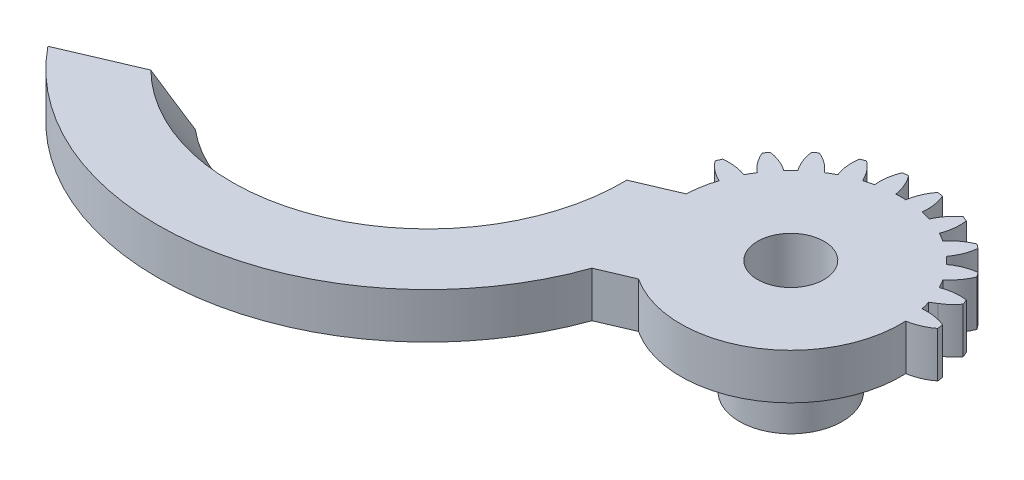
from build123d import *

# Parameters (mm, degrees)
SKETCH1_R           = 3.65
BOSS_EXTRUDE1_DEPTH = 5
SKETCH_1_R          = 5.65
SKETCH_1_R_2        = 3.65
EXTRUDE_1_DEPTH     = 7.5
EXTRUDE_2_DEPTH     = 5


with BuildPart() as part:
    # Sketch1 → Boss-Extrude1 (new body)
    with BuildSketch(Plane(origin=(0, 4, 0), x_dir=(1, 0, 0), z_dir=(0, 1, 0))):
        with BuildLine():
            Line((1.43808022, 3.600125745), (2.081641936, 4))
            ThreePointArc((2.081641936, 4), (2.861028333, 4.588201733), (3.521749436, 5.30713988))
            ThreePointArc((3.521749436, 5.30713988), (3.405395609, 5.596745198), (3.282888305, 5.883801663))
            ThreePointArc((3.282888305, 5.883801663), (1.93527598, 5.894040025), (0.627094961, 5.57027124))
            ThreePointArc((0.627094961, 5.57027124), (0.366286148, 6.046375), (0.084372603, 6.510293938))
            ThreePointArc((0.084372603, 6.510293938), (1.018855105, 7.48132754), (1.683794586, 8.65351323))
            ThreePointArc((1.683794586, 8.65351323), (1.496450048, 8.903135899), (1.303821399, 9.148703928))
            ThreePointArc((1.303821399, 9.148703928), (-0.000522033, 8.809805691), (-1.180330337, 8.158486898))
            ThreePointArc((-1.180330337, 8.158486898), (-1.555477026, 8.550865528), (-1.947855656, 8.926012217))
            ThreePointArc((-1.947855656, 8.926012217), (-1.296536862, 10.105820521), (-0.957638625, 11.410163953))
            ThreePointArc((-0.957638625, 11.410163953), (-1.203206655, 11.602792602), (-1.452829324, 11.79013714))
            ThreePointArc((-1.452829324, 11.79013714), (-2.625015014, 11.125197659), (-3.596048616, 10.190715157))
            ThreePointArc((-3.596048616, 10.190715157), (-4.059967554, 10.472628702), (-4.536071314, 10.733437515))
            ThreePointArc((-4.536071314, 10.733437515), (-4.212302529, 12.041618533), (-4.222540891, 13.389230859))
            ThreePointArc((-4.222540891, 13.389230859), (-4.509597355, 13.511738163), (-4.799202674, 13.62809199))
            ThreePointArc((-4.799202674, 13.62809199), (-5.759348103, 12.682425791), (-6.455432668, 11.528463019))
            ThreePointArc((-6.455432668, 11.528463019), (-6.976508546, 11.680699536), (-7.503891752, 11.809396783))
            ThreePointArc((-7.503891752, 11.809396783), (-7.529737283, 13.156800143), (-7.888414517, 14.455843809))
            ThreePointArc((-7.888414517, 14.455843809), (-8.197396993, 14.499881098), (-8.507248835, 14.537314892))
            ThreePointArc((-8.507248835, 14.537314892), (-9.18992168, 13.375367565), (-9.563620196, 12.080565177))
            ThreePointArc((-9.563620196, 12.080565177), (-10.106342554, 12.09275), (-10.649064912, 12.080565177))
            ThreePointArc((-10.649064912, 12.080565177), (-11.022763428, 13.375367565), (-11.705436272, 14.537314892))
            ThreePointArc((-11.705436272, 14.537314892), (-12.015288115, 14.499881098), (-12.324270591, 14.455843809))
            ThreePointArc((-12.324270591, 14.455843809), (-12.682947825, 13.156800143), (-12.708793355, 11.809396783))
            ThreePointArc((-12.708793355, 11.809396783), (-13.236176561, 11.680699536), (-13.757252439, 11.528463019))
            ThreePointArc((-13.757252439, 11.528463019), (-14.453337005, 12.682425791), (-15.413482434, 13.62809199))
            ThreePointArc((-15.413482434, 13.62809199), (-15.703087752, 13.511738163), (-15.990144217, 13.389230859))
            ThreePointArc((-15.990144217, 13.389230859), (-16.000382579, 12.041618533), (-15.676613793, 10.733437515))
            ThreePointArc((-15.676613793, 10.733437515), (-16.152717554, 10.472628702), (-16.616636492, 10.190715157))
            ThreePointArc((-16.616636492, 10.190715157), (-17.587670094, 11.125197659), (-18.759855783, 11.79013714))
            ThreePointArc((-18.759855783, 11.79013714), (-19.009478453, 11.602792602), (-19.255046482, 11.410163953))
            ThreePointArc((-19.255046482, 11.410163953), (-18.916148245, 10.105820521), (-18.264829452, 8.926012217))
            ThreePointArc((-18.264829452, 8.926012217), (-18.657208082, 8.550865528), (-19.032354771, 8.158486898))
            ThreePointArc((-19.032354771, 8.158486898), (-20.212163074, 8.809805691), (-21.516506507, 9.148703928))
            ThreePointArc((-21.516506507, 9.148703928), (-21.709135156, 8.903135899), (-21.896479694, 8.65351323))
            ThreePointArc((-21.896479694, 8.65351323), (-21.231540213, 7.48132754), (-20.297057711, 6.510293938))
            ThreePointArc((-20.297057711, 6.510293938), (-20.578971255, 6.046375), (-20.839780068, 5.57027124))
            ThreePointArc((-20.839780068, 5.57027124), (-22.147961087, 5.894040025), (-23.495573413, 5.883801663))
            ThreePointArc((-23.495573413, 5.883801663), (-23.618080717, 5.596745198), (-23.734434544, 5.30713988))
            ThreePointArc((-23.734434544, 5.30713988), (-22.788768345, 4.346994451), (-21.634805572, 3.650909885))
            ThreePointArc((-21.634805572, 3.650909885), (-21.803584999, 3.067429176), (-21.942853375, 2.47620963))
            ThreePointArc((-21.942853375, 2.47620963), (-22.095637401, -1.578420611), (-20.898643838, -5.455349261))
            ThreePointArc((-20.898643838, -5.455349261), (-7.038913378, -11.697242445), (1.974222624, 0.542722358))
            ThreePointArc((1.974222624, 0.542722358), (3.269025011, 0.916420874), (4.430972339, 1.599093719))
            ThreePointArc((4.430972339, 1.599093719), (4.393538544, 1.908945561), (4.349501255, 2.217928037))
            ThreePointArc((4.349501255, 2.217928037), (3.050457589, 2.576605271), (1.70305423, 2.602450802))
            ThreePointArc((1.70305423, 2.602450802), (1.581217534, 3.104116905), (1.43808022, 3.600125745))
        make_face()
        with Locations(Location((-10.106342554, 0, 0), (0, 0, 90))):
            Circle(SKETCH1_R, mode=Mode.SUBTRACT)
    extrude(amount=-BOSS_EXTRUDE1_DEPTH)

    # 草图1 → 凸台-拉伸1 (add)
    with BuildSketch(Plane.XZ.offset(1)):
        with Locations(Location((-10.106342554, 0, 0), (0, 0, 90))):
            Circle(SKETCH_1_R)
        with Locations(Location((-10.106342554, 0, 0), (0, 0, 270))):
            Circle(SKETCH_1_R_2, mode=Mode.SUBTRACT)
    extrude(amount=EXTRUDE_1_DEPTH)

    # 草图2 → 凸台-拉伸2 (add)
    with BuildSketch(Plane(origin=(0, 4, 0), x_dir=(1, 0, 0), z_dir=(0, 1, 0))):
        with BuildLine():
            Line((-20.290866754, -11.657484407), (-16.715112634, -10.127129929))
            Line((-16.715112634, -10.127129929), (-22.184948493, 0.584706011))
            Line((-22.184948493, 0.584706011), (-30.168856615, -2.832254199))
            ThreePointArc((-30.168856615, -2.832254199), (-41.120771134, -18.396815496), (-59.941897602, -15.574547178))
            Line((-59.941897602, -15.574547178), (-71.283909207, -20.428711551))
            ThreePointArc((-71.283909207, -20.428711551), (-43.218414154, -30.97827059), (-20.290866754, -11.657484407))
        make_face()
    extrude(amount=-EXTRUDE_2_DEPTH)

    # 草图3 → 切除-旋转1 (revolve, cut)
    with BuildSketch(Plane(origin=(-18.284564858, 0, -22.548473972), x_dir=(0.7767217347580433, 0, -0.6298439066581941), z_dir=(0.6298439066581941, 0, 0.7767217347580433))):
        Polygon((-60.074661111, 4), (-56.274661111, -1.234092457), (-56.274661111, 4), align=None)
    revolve(axis=Axis((-48.246342554, -1, 1.74754128), (0, 1, 0)), mode=Mode.SUBTRACT)


solid = part.part
